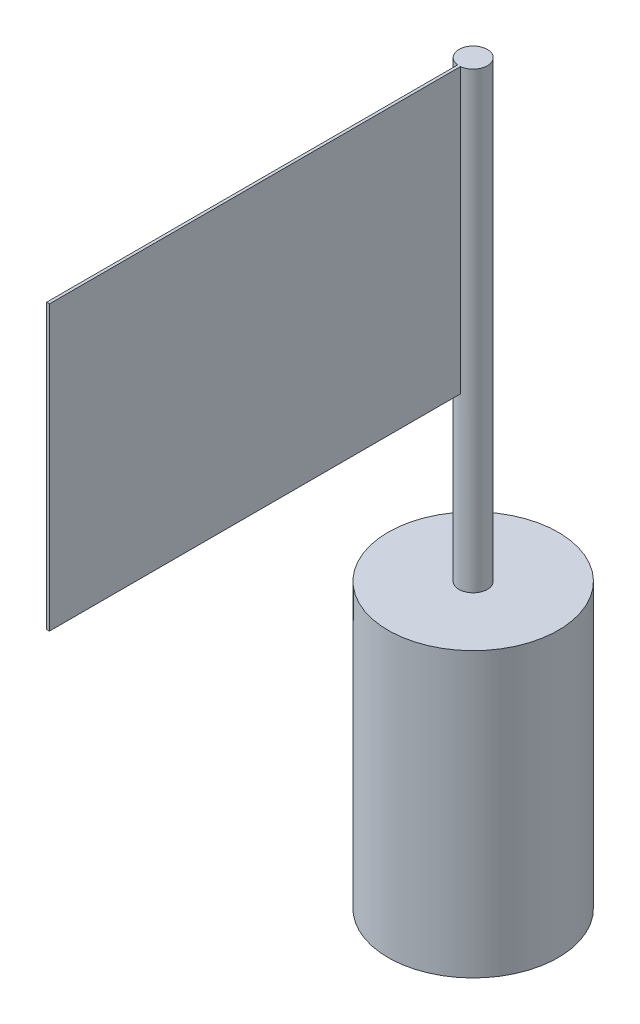
from build123d import *

# Parameters (mm, degrees)
SKETCH2_W           = 1
SKETCH2_H           = 100
BOSS_EXTRUDE1_DEPTH = 150


with BuildPart() as part:
    # Sketch1 → Revolve1 (revolve)
    with BuildSketch(Plane.XY):
        Polygon((0, 0), (-30, 0), (-30, 100), (-5, 100), (-5, 260), (0, 260), align=None)
    revolve(axis=Axis((0, 260, 0), (0, -1, 0)))

    # Sketch2 → Boss-Extrude1 (add)
    with BuildSketch(Plane.XY):
        with Locations((0, 210)):
            Rectangle(SKETCH2_W, SKETCH2_H)
    extrude(amount=BOSS_EXTRUDE1_DEPTH)


solid = part.part
